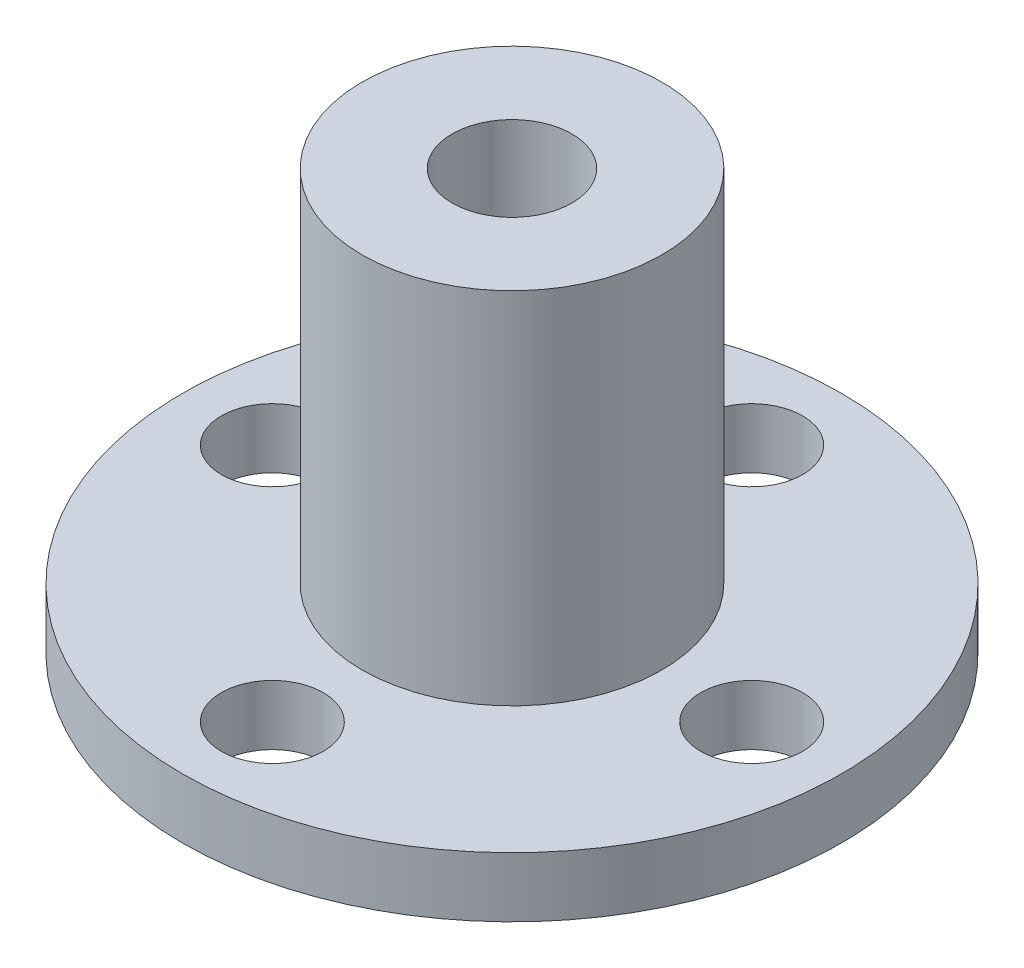
from build123d import *

# Parameters (mm, degrees)
SKETCH1_R           = 11
BOSS_EXTRUDE1_DEPTH = 2
SKETCH2_R           = 5
BOSS_EXTRUDE2_DEPTH = 12
SKETCH3_R           = 2
CUT_EXTRUDE1_DEPTH  = 21.928449536
SKETCH4_R           = 1.7
CUT_EXTRUDE2_DEPTH  = 20.646882704


with BuildPart() as part:
    # Sketch1 → Boss-Extrude1 (new body)
    with BuildSketch(Plane(origin=(0, 0, 0), x_dir=(1, 0, 0), z_dir=(0, 1, 0))):
        with Locations(Location((0, 0, 0), (0, 0, 270))):
            Circle(SKETCH1_R)
    extrude(amount=BOSS_EXTRUDE1_DEPTH)

    # Sketch2 → Boss-Extrude2 (add)
    with BuildSketch(Plane(origin=(0, 2, 0), x_dir=(1, 0, 0), z_dir=(0, 1, 0))):
        with Locations(Location((0, 0, 0), (0, 0, 270))):
            Circle(SKETCH2_R)
    extrude(amount=BOSS_EXTRUDE2_DEPTH)

    # Sketch3 → Cut-Extrude1 (cut, through all)
    with BuildSketch(Plane(origin=(0, 14, 0), x_dir=(1, 0, 0), z_dir=(0, 1, 0))):
        with Locations(Location((0, 0, 0), (0, 0, 270))):
            Circle(SKETCH3_R)
    extrude(amount=-CUT_EXTRUDE1_DEPTH, mode=Mode.SUBTRACT)

    # Sketch4 → Cut-Extrude2 (cut, through all)
    with BuildSketch(Plane(origin=(0, 2, 0), x_dir=(1, 0, 0), z_dir=(0, 1, 0))):
        with Locations(Location((0, 8, 0), (0, 0, 270))):
            Circle(SKETCH4_R)
        with Locations(Location((8, 0, 0), (0, 0, 270))):
            Circle(SKETCH4_R)
        with Locations(Location((0, -8, 0), (0, 0, 270))):
            Circle(SKETCH4_R)
        with Locations(Location((-8, 0, 0), (0, 0, 270))):
            Circle(SKETCH4_R)
    extrude(amount=-CUT_EXTRUDE2_DEPTH, mode=Mode.SUBTRACT)


solid = part.part
